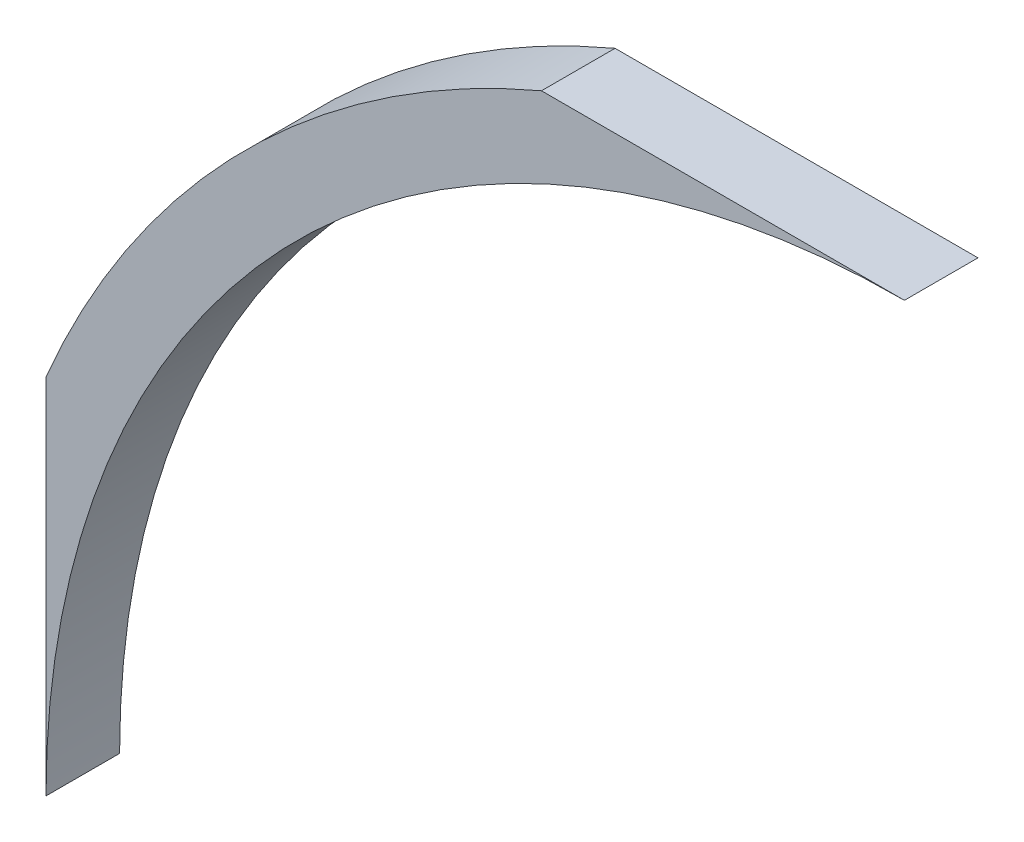
from build123d import *

# Parameters (mm, degrees)
BOSS_EXTRUDE1_DEPTH = 6


with BuildPart() as part:
    # Sketch1 → Boss-Extrude1 (new body)
    with BuildSketch(Plane(origin=(0, 0, 0), x_dir=(0, 1, 0), z_dir=(0, 0, 1))):
        with BuildLine():
            Line((0, 70), (29.597297174, 70))
            ThreePointArc((29.597297174, 70), (53.74011537, 53.74011537), (70, 29.597297174))
            Line((70, 29.597297174), (70, 0))
            ThreePointArc((70, 0), (49.497474683, 49.497474683), (0, 70))
        make_face()
    extrude(amount=BOSS_EXTRUDE1_DEPTH)


solid = part.part
